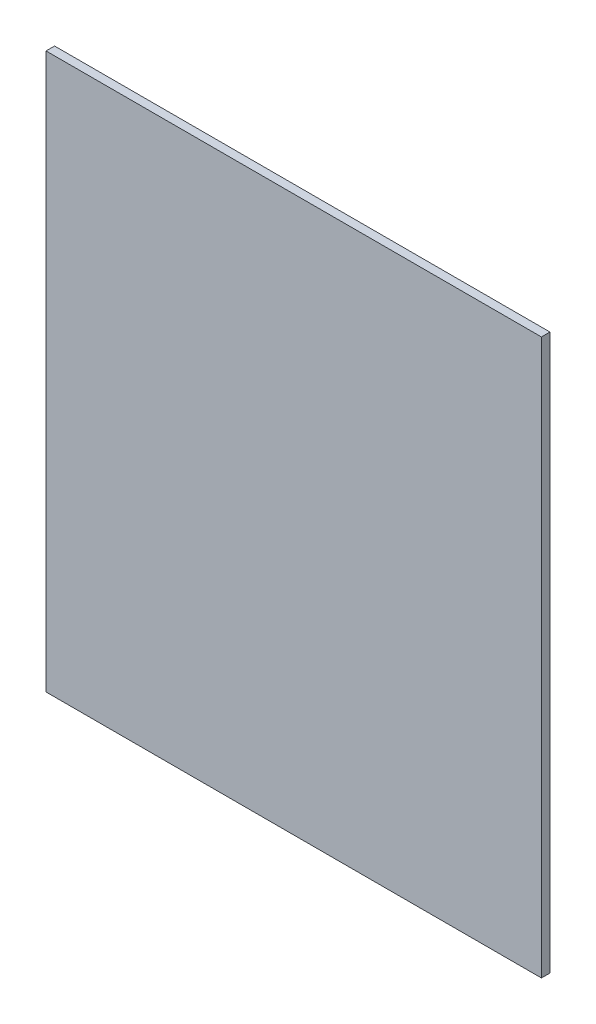
from build123d import *

# Parameters (mm, degrees)
ESQUISSE1_W        = 116
ESQUISSE1_H        = 130
BOSS_EXTRU_1_DEPTH = 2


with BuildPart() as part:
    # Esquisse1 → Boss.-Extru.1 (new body)
    with BuildSketch(Plane.XY):
        with Locations((58, 65)):
            Rectangle(ESQUISSE1_W, ESQUISSE1_H)
    extrude(amount=BOSS_EXTRU_1_DEPTH)


solid = part.part
